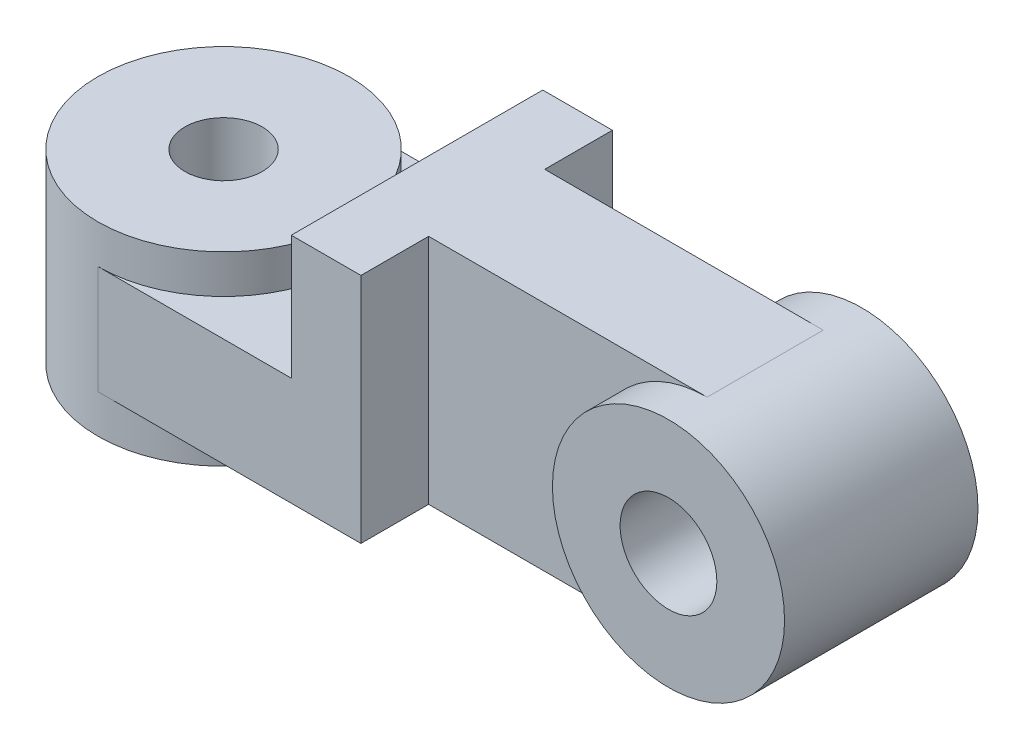
from build123d import *

# Parameters (mm, degrees)
SKETCH1_R           = 10
BOSS_EXTRUDE1_DEPTH = 24
BOSS_EXTRUDE2_DEPTH = 14
SKETCH2_W           = 65
SKETCH2_H           = 60
BOSS_EXTRUDE3_DEPTH = 18
BOSS_EXTRUDE4_DEPTH = 15
SKETCH4_3_R         = 30
SKETCH4_3_R_2       = 12.500000000000002
BOSS_EXTRUDE5_DEPTH = 25


with BuildPart() as part:
    # Sketch1 → Boss-Extrude1 (new, symmetric)
    with BuildSketch(Plane(origin=(0, 0, 0), x_dir=(1, 0, 0), z_dir=(0, 1, 0))):
        with BuildLine():
            ThreePointArc((1.99e-15, 32.5), (-32.5, 3.98e-15), (-5.97e-15, -32.5))
            ThreePointArc((-5.97e-15, -32.5), (22.98097038856279, -22.9809703885628), (32.5, -7.96e-15))
            ThreePointArc((32.5, 0), (22.980970388562795, 22.980970388562792), (1.99e-15, 32.5))
        make_face()
        Circle(SKETCH1_R, mode=Mode.SUBTRACT)
    extrude(amount=BOSS_EXTRUDE1_DEPTH, both=True)

    # Sketch1<3> → Boss-Extrude2 (add, symmetric)
    with BuildSketch(Plane(origin=(0, 0, 0), x_dir=(1, 0, 0), z_dir=(0, 1, 0))):
        with BuildLine():
            ThreePointArc((32.5, -7.96e-15), (22.98097038856279, -22.9809703885628), (-5.97e-15, -32.5))
            Line((0, -32.5), (50, -32.5))
            Line((50, -32.5), (50, 32.5))
            Line((50, 32.5), (0, 32.5))
            ThreePointArc((1.99e-15, 32.5), (22.980970388562795, 22.980970388562792), (32.5, 0))
        make_face()
    extrude(amount=BOSS_EXTRUDE2_DEPTH, both=True)

    # Sketch2 → Boss-Extrude3 (add)
    with BuildSketch(Plane(origin=(50, 0, 0), x_dir=(0, 0, -1), z_dir=(1, 0, 0))):
        with Locations((0, 16)):
            Rectangle(SKETCH2_W, SKETCH2_H)
    extrude(amount=BOSS_EXTRUDE3_DEPTH)

    # Sketch4 → Boss-Extrude4 (add, symmetric)
    with BuildSketch(Plane.XY):
        with BuildLine():
            Line((140, 46), (68, 46))
            Line((68, 46), (68, -14))
            Line((68, -14), (140, -14))
            ThreePointArc((140, -13.999999999999996), (110, 16.000000000000004), (140, 46))
        make_face()
    extrude(amount=BOSS_EXTRUDE4_DEPTH, both=True)

    # Sketch4<3> → Boss-Extrude5 (add, symmetric)
    with BuildSketch(Plane.XY):
        with Locations((140, 16)):
            Circle(SKETCH4_3_R)
        with Locations((140, 16)):
            Circle(SKETCH4_3_R_2, mode=Mode.SUBTRACT)
    extrude(amount=BOSS_EXTRUDE5_DEPTH, both=True)


solid = part.part
